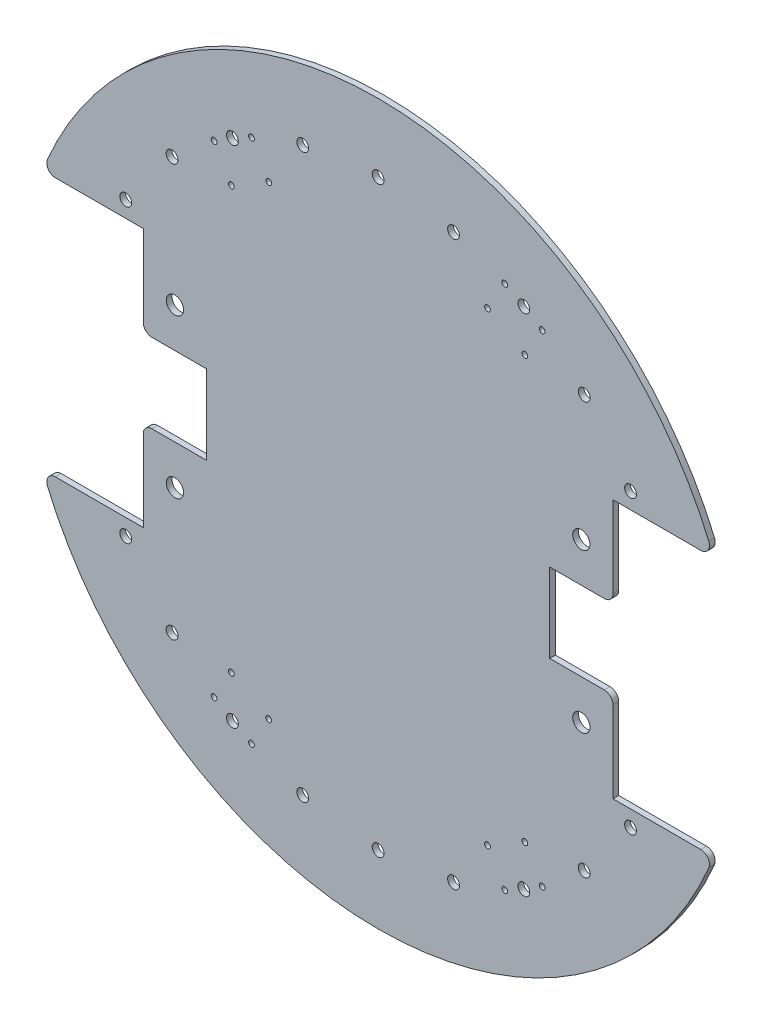
from build123d import *

# Parameters (mm, degrees)
SKETCH1_R           = 6
SKETCH1_R_2         = 4.1
BOSS_EXTRUDE1_DEPTH = 4
SKETCH5_R           = 2
CUT_EXTRUDE3_DEPTH  = 10


with BuildPart() as part:
    # Sketch1 → Boss-Extrude1 (new body)
    with BuildSketch(Plane.XY):
        with BuildLine():
            Line((-163.238075794, -33.5), (-163.238075794, -90))
            Line((-163.238075794, -90), (-224.321198285, -90))
            ThreePointArc((-224.321198285, -90), (-229.329388299, -92.695755338), (-229.837293325, -98.360655738))
            ThreePointArc((-229.837293325, -98.360655738), (0, -250), (229.837293325, -98.360655738))
            ThreePointArc((229.837293325, -98.360655738), (229.329388299, -92.695755338), (224.321198285, -90))
            Line((224.321198285, -90), (163.238075794, -90))
            Line((163.238075794, -90), (163.238075794, -33.5))
            ThreePointArc((163.238075794, -33.5), (161.480716481, -29.257359313), (157.238075794, -27.5))
            Line((157.238075794, -27.5), (119.238075794, -27.5))
            Line((119.238075794, -27.5), (119.238075794, 27.5))
            Line((119.238075794, 27.5), (157.238075794, 27.5))
            ThreePointArc((157.238075794, 27.5), (161.480716481, 29.257359313), (163.238075794, 33.5))
            Line((163.238075794, 33.5), (163.238075794, 90))
            Line((163.238075794, 90), (224.321198285, 90))
            ThreePointArc((224.321198285, 90), (229.329388299, 92.695755338), (229.837293325, 98.360655738))
            ThreePointArc((229.837293325, 98.360655738), (0, 250), (-229.837293325, 98.360655738))
            ThreePointArc((-229.837293325, 98.360655738), (-229.329388299, 92.695755338), (-224.321198285, 90))
            Line((-224.321198285, 90), (-163.238075794, 90))
            Line((-163.238075794, 90), (-163.238075794, 33.5))
            ThreePointArc((-163.238075794, 33.5), (-161.480716481, 29.257359313), (-157.238075794, 27.5))
            Line((-157.238075794, 27.5), (-119.238075794, 27.5))
            Line((-119.238075794, 27.5), (-119.238075794, -27.5))
            Line((-119.238075794, -27.5), (-157.238075794, -27.5))
            ThreePointArc((-157.238075794, -27.5), (-161.480716481, -29.257359313), (-163.238075794, -33.5))
        make_face()
        with Locations((-141.238075794, 55)):
            Circle(SKETCH1_R, mode=Mode.SUBTRACT)
        with Locations((-141.238075794, -55)):
            Circle(SKETCH1_R, mode=Mode.SUBTRACT)
        with Locations((141.238075794, -55)):
            Circle(SKETCH1_R, mode=Mode.SUBTRACT)
        with Locations((141.238075794, 55)):
            Circle(SKETCH1_R, mode=Mode.SUBTRACT)
        with Locations((0, -202.556165051)):
            Circle(SKETCH1_R_2, mode=Mode.SUBTRACT)
        with Locations((-52.425393218, -195.654231096)):
            Circle(SKETCH1_R_2, mode=Mode.SUBTRACT)
        with Locations((-101.278082525, -175.418784627)):
            Circle(SKETCH1_R_2, mode=Mode.SUBTRACT)
        with Locations((-143.228837878, -143.228837878)):
            Circle(SKETCH1_R_2, mode=Mode.SUBTRACT)
        with Locations((-175.418784627, -101.278082525)):
            Circle(SKETCH1_R_2, mode=Mode.SUBTRACT)
        with Locations((-175.418784627, 101.278082525)):
            Circle(SKETCH1_R_2, mode=Mode.SUBTRACT)
        with Locations((-143.228837878, 143.228837878)):
            Circle(SKETCH1_R_2, mode=Mode.SUBTRACT)
        with Locations((-101.278082525, 175.418784627)):
            Circle(SKETCH1_R_2, mode=Mode.SUBTRACT)
        with Locations((-52.425393218, 195.654231096)):
            Circle(SKETCH1_R_2, mode=Mode.SUBTRACT)
        with Locations((0, 202.556165051)):
            Circle(SKETCH1_R_2, mode=Mode.SUBTRACT)
        with Locations((52.425393218, 195.654231096)):
            Circle(SKETCH1_R_2, mode=Mode.SUBTRACT)
        with Locations((101.278082525, 175.418784627)):
            Circle(SKETCH1_R_2, mode=Mode.SUBTRACT)
        with Locations((143.228837878, 143.228837878)):
            Circle(SKETCH1_R_2, mode=Mode.SUBTRACT)
        with Locations((175.418784627, 101.278082525)):
            Circle(SKETCH1_R_2, mode=Mode.SUBTRACT)
        with Locations((175.418784627, -101.278082525)):
            Circle(SKETCH1_R_2, mode=Mode.SUBTRACT)
        with Locations((143.228837878, -143.228837878)):
            Circle(SKETCH1_R_2, mode=Mode.SUBTRACT)
        with Locations((101.278082525, -175.418784627)):
            Circle(SKETCH1_R_2, mode=Mode.SUBTRACT)
        with Locations((52.425393218, -195.654231096)):
            Circle(SKETCH1_R_2, mode=Mode.SUBTRACT)
    extrude(amount=BOSS_EXTRUDE1_DEPTH)

    # Sketch5 → Cut-Extrude3 (cut)
    with BuildSketch(Plane.XY.offset(4)):
        with Locations((-101.990381057, 146.652521874)):
            Circle(SKETCH5_R)
        with Locations((-76.009618943, 161.652521874)):
            Circle(SKETCH5_R)
        with Locations((-113.990381057, 167.437131564)):
            Circle(SKETCH5_R)
        with Locations((-88.009618943, 182.437131564)):
            Circle(SKETCH5_R)
        with Locations((76.009618943, 161.652521874)):
            Circle(SKETCH5_R)
        with Locations((101.990381057, 146.652521874)):
            Circle(SKETCH5_R)
        with Locations((88.009618943, 182.437131564)):
            Circle(SKETCH5_R)
        with Locations((113.990381057, 167.437131564)):
            Circle(SKETCH5_R)
        with Locations((101.990381057, -146.652521874)):
            Circle(SKETCH5_R)
        with Locations((76.009618943, -161.652521874)):
            Circle(SKETCH5_R)
        with Locations((113.990381057, -167.437131564)):
            Circle(SKETCH5_R)
        with Locations((88.009618943, -182.437131564)):
            Circle(SKETCH5_R)
        with Locations((-76.009618943, -161.652521874)):
            Circle(SKETCH5_R)
        with Locations((-101.990381057, -146.652521874)):
            Circle(SKETCH5_R)
        with Locations((-88.009618943, -182.437131564)):
            Circle(SKETCH5_R)
        with Locations((-113.990381057, -167.437131564)):
            Circle(SKETCH5_R)
    extrude(amount=-CUT_EXTRUDE3_DEPTH, mode=Mode.SUBTRACT)


solid = part.part
